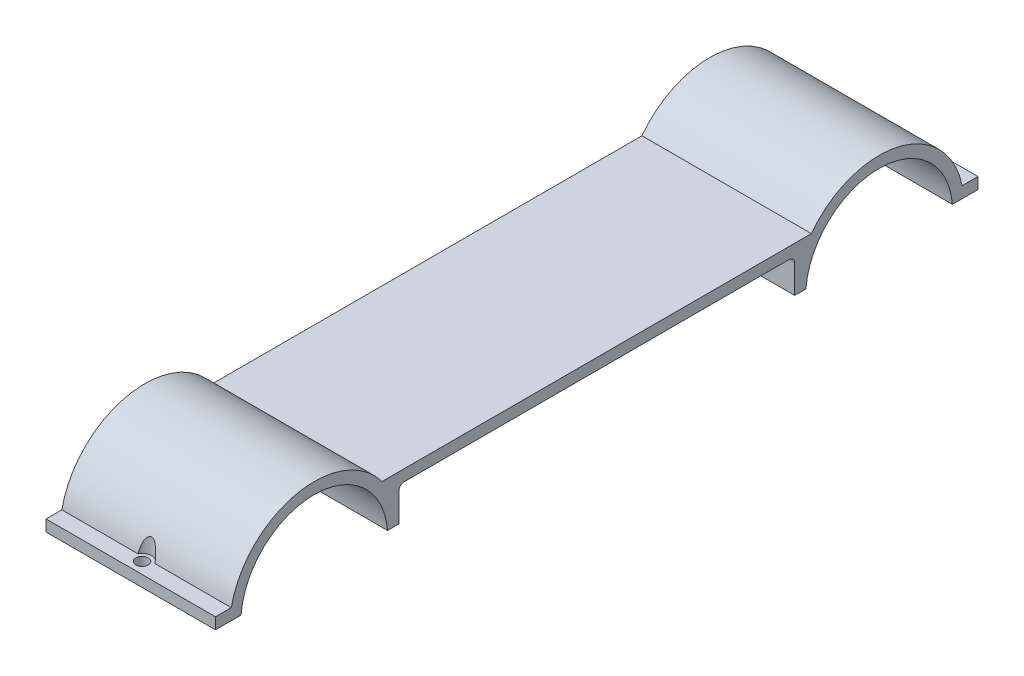
from build123d import *

# Parameters (mm, degrees)
EXTRUDE_1_DEPTH      = 15
EXTRUDE_1_DEPTH_BACK = 15
FILLET_4_R           = 1
SKETCH_2_R           = 1.1
CUT_EXTRUDE_1_DEPTH  = 10
SKETCH_3_R           = 1.703478165
CUT_EXTRUDE_2_DEPTH  = 10


with BuildPart() as part:
    # Эскиз1 → Бобышка-Вытянуть1 (new, two sides: drawn at the far end of the back side and taken through both)
    with BuildSketch(Plane(origin=(0, 0, 0), x_dir=(0, 0, -1), z_dir=(1, 0, 0)).offset(-EXTRUDE_1_DEPTH_BACK)):
        with BuildLine():
            Line((-67.5, 3), (-67.5, 1))
            Line((-67.5, 1), (-62.961481397, 1))
            ThreePointArc((-62.961481397, 1), (-50, 13), (-37.038518603, 1))
            Line((-37.038518603, 1), (-35.038518603, 1))
            Line((-35.038518603, 1), (-35.038518603, 7))
            Line((-35.038518603, 7), (35.038518603, 7))
            Line((35.038518603, 7), (35.038518603, 1))
            Line((35.038518603, 1), (37.038518603, 1))
            ThreePointArc((37.038518603, 1), (50, 13), (62.961481397, 1))
            Line((62.961481397, 1), (67.5, 1))
            Line((67.5, 1), (67.5, 3))
            Line((67.5, 3), (64.696938457, 3))
            ThreePointArc((64.696938457, 3), (53.289128952, 14.634945533), (38, 9))
            Line((38, 9), (-38, 9))
            ThreePointArc((-38, 9), (-53.289128952, 14.634945533), (-64.696938457, 3))
            Line((-64.696938457, 3), (-67.5, 3))
        make_face()
    extrude(amount=EXTRUDE_1_DEPTH + EXTRUDE_1_DEPTH_BACK)

    # Скругление4
    fillet_4_edges = [part.edges().sort_by_distance(p)[0] for p in [
        (0, 7, -35.038518603),
        (0, 7, 35.038518603),
    ]]
    fillet(fillet_4_edges, radius=FILLET_4_R)

    # Эскиз2 → Вырез-Вытянуть1 (cut, symmetric)
    with BuildSketch(Plane(origin=(0, 3, 0), x_dir=(1, 0, 0), z_dir=(0, 1, 0))):
        with Locations((0, 65.5)):
            Circle(SKETCH_2_R)
    cut_extrude_1 = extrude(amount=CUT_EXTRUDE_1_DEPTH, both=True, mode=Mode.SUBTRACT)

    # Эскиз3 → Вырез-Вытянуть2 (cut)
    with BuildSketch(Plane(origin=(0, 3, 0), x_dir=(1, 0, 0), z_dir=(0, 1, 0))):
        with Locations((0, 65.5)):
            Circle(SKETCH_3_R)
    cut_extrude_2 = extrude(amount=CUT_EXTRUDE_2_DEPTH, mode=Mode.SUBTRACT)

    # Зеркальное отражение1: Вырез-Вытянуть1, Вырез-Вытянуть2 across plane
    add(cut_extrude_1.mirror(Plane.XY), mode=Mode.SUBTRACT)
    add(cut_extrude_2.mirror(Plane.XY), mode=Mode.SUBTRACT)


solid = part.part
